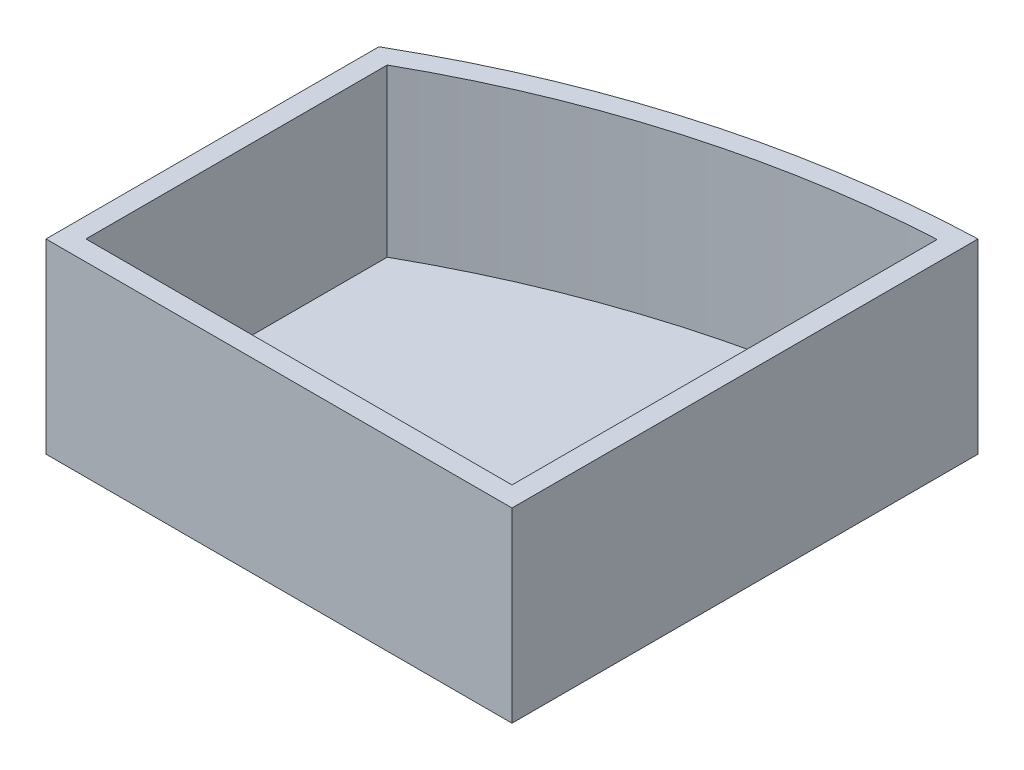
from build123d import *

# Parameters (mm, degrees)
BOSS_EXTRUDE1_DEPTH             = 3
BOSS_EXTRUDE2_DEPTH             = 25
SKETCH4_R                       = 2.5
BOSS_EXTRUDE3_DEPTH             = 7
BOSS_EXTRUDE3_DIRECTION_2_REACH = 85.256


with BuildPart() as part:
    # Sketch1 → Boss-Extrude1 (new body)
    with BuildSketch(Plane(origin=(0, 0, 0), x_dir=(1, 0, 0), z_dir=(0, 1, 0))):
        with BuildLine():
            Line((0, 0), (0, -70))
            Line((0, -70), (-70, -70))
            Line((-70, -70), (-70, -20))
            ThreePointArc((-70, -20), (-36.231761047, -5.688836334), (0, 0))
        make_face()
    extrude(amount=BOSS_EXTRUDE1_DEPTH)

    # Sketch2 → Boss-Extrude2 (add)
    with BuildSketch(Plane(origin=(0, 3, 0), x_dir=(1, 0, 0), z_dir=(0, 1, 0))):
        with BuildLine():
            Line((-70, -70), (0, -70))
            Line((0, -70), (0, 0))
            ThreePointArc((0, 0), (-36.231761047, -5.688836334), (-70, -20))
            Line((-70, -20), (-70, -70))
        make_face()
        with BuildLine():
            Line((-67, -21.744121307), (-67, -67))
            Line((-67, -67), (-3, -67))
            Line((-3, -67), (-3, -3.133993062))
            ThreePointArc((-3, -3.133993062), (-36.068657655, -8.763956776), (-67, -21.744121307))
        make_face(mode=Mode.SUBTRACT)
    extrude(amount=BOSS_EXTRUDE2_DEPTH)

    # Sketch4 → Boss-Extrude3 (add)
    with BuildSketch(Plane(origin=(-61.178699811, 14, 15.293872991), x_dir=(-0.8974903699241336, 0, 0.4410340529862088), z_dir=(-0.4410340529862088, 0, -0.8974903699241336))):
        with Locations((-25.829909239, 0)):
            Circle(SKETCH4_R)
    extrude(amount=BOSS_EXTRUDE3_DEPTH)

    # Sketch4 → Boss-Extrude3 direction 2 (add, up to next)
    with BuildSketch(Plane(origin=(-61.178699811, 14, 15.293872991), x_dir=(-0.8974903699241336, 0, 0.4410340529862088), z_dir=(-0.4410340529862088, 0, -0.8974903699241336)), mode=Mode.PRIVATE) as boss_extrude3_direction_2_sk1:
        with Locations((-25.829909239, 0)):
            Circle(SKETCH4_R)
    boss_extrude3_direction_2_tool1 = extrude(boss_extrude3_direction_2_sk1.sketch, amount=-BOSS_EXTRUDE3_DIRECTION_2_REACH, mode=Mode.PRIVATE) - part.part
    add(boss_extrude3_direction_2_tool1.solids().sort_by_distance((-37.996605, 14, 3.902003))[0])


solid = part.part
